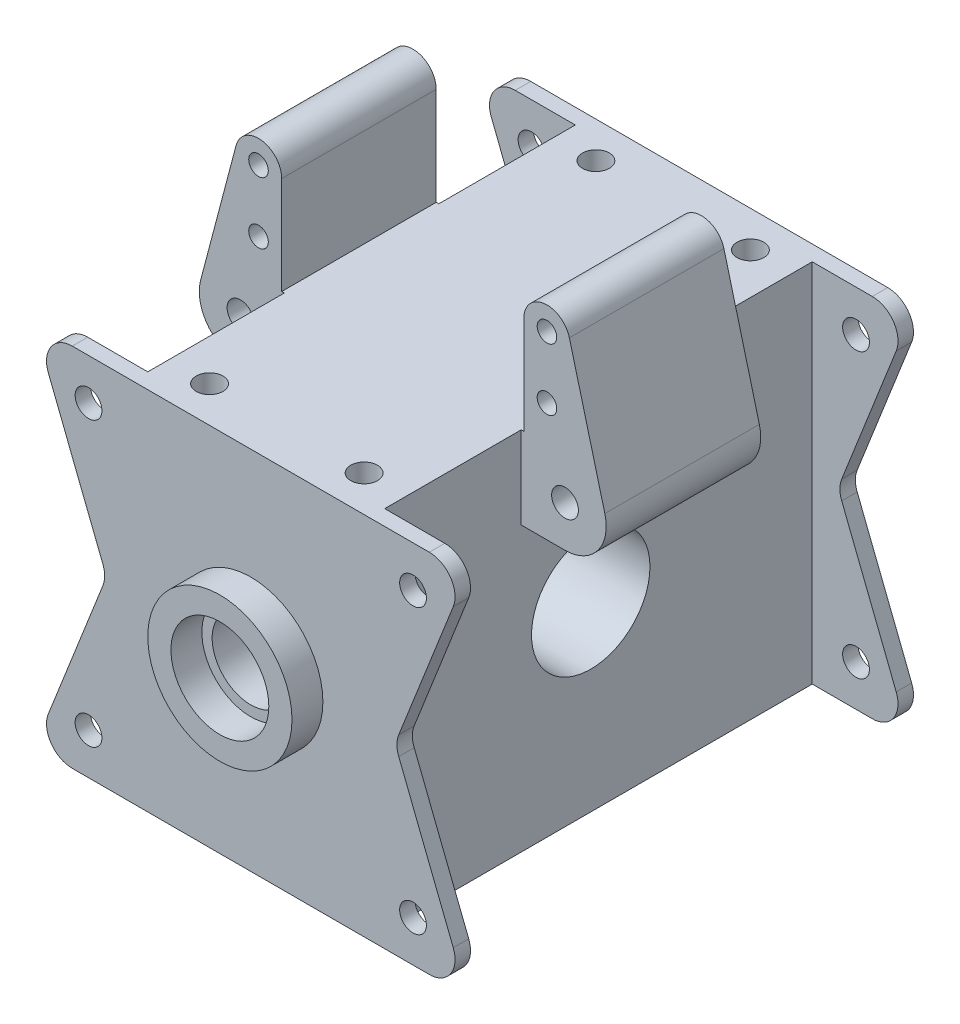
from build123d import *

# Parameters (mm, degrees)
SKETCH_1_W          = 46
SKETCH_1_H          = 89
EXTRUDE_1_DEPTH     = 35.5
SKETCH_3_R          = 2.6
EXTRUDE_2_DEPTH     = 3
EXTRUDE_START       = -3
SKETCH_4_R          = 2.6
EXTRUDE_3_DEPTH     = 3
SKETCH_5_R          = 14
EXTRUDE_4_DEPTH     = 6
SKETCH_6_R          = 11.5
CUT_EXTRUDE_1_DEPTH = 88.954242748
SKETCH_7_R          = 2.6
EXTRUDE_5_DEPTH     = 15
SKETCH_8_R          = 1.9
SKETCH_8_R_2        = 4.5
EXTRUDE_6_DEPTH     = 15
SKETCH_9_R          = 2.6
CUT_EXTRUDE_2_DEPTH = 115.249255194
SKETCH_10_R         = 9.5
CUT_EXTRUDE_3_DEPTH = 6
SKETCH_11_R         = 7.5
CUT_EXTRUDE_4_DEPTH = 6
SKETCH_12_R         = 9.5
CUT_EXTRUDE_5_DEPTH = 6


with BuildPart() as part:
    # 草图1 → 凸台-拉伸1 (new, symmetric)
    with BuildSketch(Plane(origin=(0, 0, 0), x_dir=(1, 0, 0), z_dir=(0, 1, 0))):
        Rectangle(SKETCH_1_W, SKETCH_1_H)
    extrude(amount=EXTRUDE_1_DEPTH, both=True)

    # 草图3 → 凸台-拉伸2 (add)
    # profile 1 of 2: a face of its own
    with BuildSketch(Plane.XY.offset(44.5)):
        with BuildLine():
            Line((23, 35.5), (34.653402281, 35.5))
            ThreePointArc((34.653402281, 35.5), (38.786905937, 33.313209471), (39.304766934, 28.66565901))
            Line((39.304766934, 28.66565901), (28.72340208, 1.83434099))
            ThreePointArc((28.72340208, 1.83434099), (28.374766733, 0), (28.72340208, -1.83434099))
            Line((28.72340208, -1.83434099), (39.304766934, -28.66565901))
            ThreePointArc((39.304766934, -28.66565901), (38.786905937, -33.313209471), (34.653402281, -35.5))
            Line((34.653402281, -35.5), (23, -35.5))
            Line((23, -35.5), (23, 35.5))
        make_face()
        with Locations((31.5, 27.5)):
            Circle(SKETCH_3_R, mode=Mode.SUBTRACT)
        with Locations((31.5, -27.5)):
            Circle(SKETCH_3_R, mode=Mode.SUBTRACT)
    # profile 2 of 2: a face of its own
    with BuildSketch(Plane.XY.offset(44.5)):
        with BuildLine():
            Line((-23, -35.5), (-23, 35.5))
            Line((-23, 35.5), (-34.653402281, 35.5))
            ThreePointArc((-34.653402281, 35.5), (-38.786905937, 33.313209471), (-39.304766934, 28.66565901))
            Line((-39.304766934, 28.66565901), (-28.72340208, 1.83434099))
            ThreePointArc((-28.72340208, 1.83434099), (-28.374766733, 0), (-28.72340208, -1.83434099))
            Line((-28.72340208, -1.83434099), (-39.304766934, -28.66565901))
            ThreePointArc((-39.304766934, -28.66565901), (-38.786905937, -33.313209471), (-34.653402281, -35.5))
            Line((-34.653402281, -35.5), (-23, -35.5))
        make_face()
        with Locations((-31.5, -27.5)):
            Circle(SKETCH_3_R, mode=Mode.SUBTRACT)
        with Locations((-31.5, 27.5)):
            Circle(SKETCH_3_R, mode=Mode.SUBTRACT)
    extrude(amount=-EXTRUDE_2_DEPTH)

    # 草图4 → 凸台-拉伸3 (add)
    # profile 1 of 2: a face of its own
    with BuildSketch(Plane(origin=(0, 0, -44.5), x_dir=(-1, 0, 0), z_dir=(0, 0, -1)).offset(EXTRUDE_START)):
        with BuildLine():
            Line((39.304766934, -28.66565901), (28.72340208, -1.83434099))
            ThreePointArc((28.72340208, -1.83434099), (28.374766733, 0), (28.72340208, 1.83434099))
            Line((28.72340208, 1.83434099), (39.304766934, 28.66565901))
            ThreePointArc((39.304766934, 28.66565901), (38.786905937, 33.313209471), (34.653402281, 35.5))
            Line((34.653402281, 35.5), (23, 35.5))
            Line((23, 35.5), (23, -35.5))
            Line((23, -35.5), (34.653402281, -35.5))
            ThreePointArc((34.653402281, -35.5), (38.786905937, -33.313209471), (39.304766934, -28.66565901))
        make_face()
        with Locations(Location((31.5, 27.5, 0), (0, 0, 180))):
            Circle(SKETCH_4_R, mode=Mode.SUBTRACT)
        with Locations(Location((31.5, -27.5, 0), (0, 0, 180))):
            Circle(SKETCH_4_R, mode=Mode.SUBTRACT)
    # profile 2 of 2: a face of its own
    with BuildSketch(Plane(origin=(0, 0, -44.5), x_dir=(-1, 0, 0), z_dir=(0, 0, -1)).offset(EXTRUDE_START)):
        with BuildLine():
            Line((-23, 35.5), (-34.653402281, 35.5))
            ThreePointArc((-34.653402281, 35.5), (-38.786905937, 33.313209471), (-39.304766934, 28.66565901))
            Line((-39.304766934, 28.66565901), (-28.72340208, 1.83434099))
            ThreePointArc((-28.72340208, 1.83434099), (-28.374766733, 0), (-28.72340208, -1.83434099))
            Line((-28.72340208, -1.83434099), (-39.304766934, -28.66565901))
            ThreePointArc((-39.304766934, -28.66565901), (-38.786905937, -33.313209471), (-34.653402281, -35.5))
            Line((-34.653402281, -35.5), (-23, -35.5))
            Line((-23, -35.5), (-23, 35.5))
        make_face()
        with Locations(Location((-31.5, -27.5, 0), (0, 0, 180))):
            Circle(SKETCH_4_R, mode=Mode.SUBTRACT)
        with Locations(Location((-31.5, 27.5, 0), (0, 0, 180))):
            Circle(SKETCH_4_R, mode=Mode.SUBTRACT)
    extrude(amount=EXTRUDE_3_DEPTH)

    # 草图5 → 凸台-拉伸4 (add)
    with BuildSketch(Plane.XY.offset(44.5)):
        Circle(SKETCH_5_R)
    extrude(amount=EXTRUDE_4_DEPTH)

    # 草图6 → 切除-拉伸1 (cut, through all)
    with BuildSketch(Plane(origin=(23, 0, 0), x_dir=(0, 0, -1), z_dir=(1, 0, 0))):
        with Locations((-1.5, 0)):
            Circle(SKETCH_6_R)
    extrude(amount=-CUT_EXTRUDE_1_DEPTH, mode=Mode.SUBTRACT)

    # 草图7 → 凸台-拉伸5 (add, symmetric)
    with BuildSketch(Plane.XY):
        with BuildLine():
            Line((23, 19.5), (23, 35.5))
            Line((23, 35.5), (31.5, 35.5))
            ThreePointArc((31.5, 35.5), (39.5, 27.5), (31.5, 19.5))
            Line((31.5, 19.5), (23, 19.5))
        make_face()
        with Locations((31.5, 27.5)):
            Circle(SKETCH_7_R, mode=Mode.SUBTRACT)
    extrude_5 = extrude(amount=EXTRUDE_5_DEPTH, both=True)

    # 镜向1: 凸台-拉伸5 across plane
    add(extrude_5.mirror(Plane(origin=(0, 0, 0), x_dir=(0, 0, 1), z_dir=(1, 0, 0))))

    # 草图8 → 凸台-拉伸6 (add, symmetric)
    # profile 1 of 2: a face of its own
    with BuildSketch(Plane.XY):
        with BuildLine():
            Line((39.235581788, 29.539797639), (32.351264755, 55.647386172))
            ThreePointArc((32.351264755, 55.647386172), (32.46266128, 55.078493129), (32.5, 54.5))
            ThreePointArc((32.5, 54.5), (28, 50), (23.5, 54.5))
            Line((23.5, 54.5), (23.5, 35.5))
            Line((23.5, 35.5), (31.5, 35.5))
            ThreePointArc((31.5, 35.5), (36.382705136, 33.837127942), (39.235581788, 29.539797639))
        make_face()
        with Locations((28, 42.5)):
            Circle(SKETCH_8_R, mode=Mode.SUBTRACT)
    # profile 2 of 2: a face of its own
    with BuildSketch(Plane.XY):
        with Locations((28, 54.5)):
            Circle(SKETCH_8_R_2)
        with Locations((28, 54.5)):
            Circle(SKETCH_8_R, mode=Mode.SUBTRACT)
    extrude_6 = extrude(amount=EXTRUDE_6_DEPTH, both=True)

    # 镜向2: 凸台-拉伸5, 凸台-拉伸6 across plane
    add(extrude_5.mirror(Plane(origin=(0, 0, 0), x_dir=(0, 0, 1), z_dir=(1, 0, 0))))
    add(extrude_6.mirror(Plane(origin=(0, 0, 0), x_dir=(0, 0, 1), z_dir=(1, 0, 0))))

    # 草图9 → 切除-拉伸2 (cut, through all)
    with BuildSketch(Plane.XZ.offset(35.5)):
        with Locations(Location((15, -37.5, 0), (0, 0, 270))):
            Circle(SKETCH_9_R)
        with Locations(Location((-15, -37.5, 0), (0, 0, 270))):
            Circle(SKETCH_9_R)
        with Locations(Location((-15, 37.5, 0), (0, 0, 270))):
            Circle(SKETCH_9_R)
        with Locations(Location((15, 37.5, 0), (0, 0, 270))):
            Circle(SKETCH_9_R)
    extrude(amount=-CUT_EXTRUDE_2_DEPTH, mode=Mode.SUBTRACT)

    # 草图10 → 切除-拉伸3 (cut)
    with BuildSketch(Plane.XY.offset(50.5)):
        Circle(SKETCH_10_R)
    extrude(amount=-CUT_EXTRUDE_3_DEPTH, mode=Mode.SUBTRACT)

    # 草图11 → 切除-拉伸4 (cut)
    with BuildSketch(Plane.XY.offset(44.5)):
        Circle(SKETCH_11_R)
    extrude(amount=-CUT_EXTRUDE_4_DEPTH, mode=Mode.SUBTRACT)

    # 草图12 → 切除-拉伸5 (cut)
    with BuildSketch(Plane.XY.offset(38.5)):
        Circle(SKETCH_12_R)
    extrude(amount=-CUT_EXTRUDE_5_DEPTH, mode=Mode.SUBTRACT)


solid = part.part
